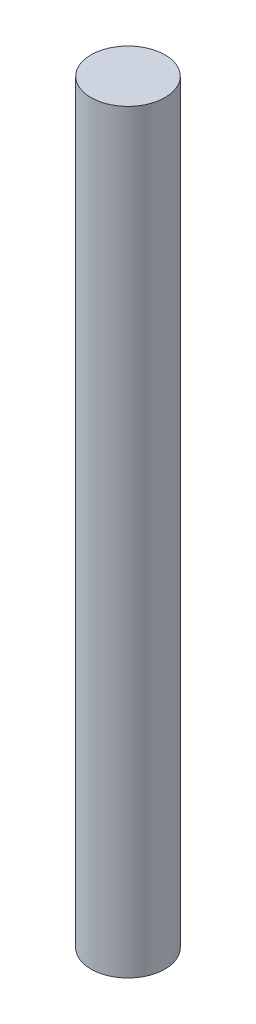
from build123d import *

# Parameters (mm, degrees)
SKETCH1_R           = 9.8
BOSS_EXTRUDE1_DEPTH = 200


with BuildPart() as part:
    # Sketch1 → Boss-Extrude1 (new body)
    with BuildSketch(Plane(origin=(0, 0, 0), x_dir=(1, 0, 0), z_dir=(0, 1, 0))):
        with Locations(Location((0, 0, 0), (0, 0, 270))):
            Circle(SKETCH1_R)
    extrude(amount=BOSS_EXTRUDE1_DEPTH)


solid = part.part
